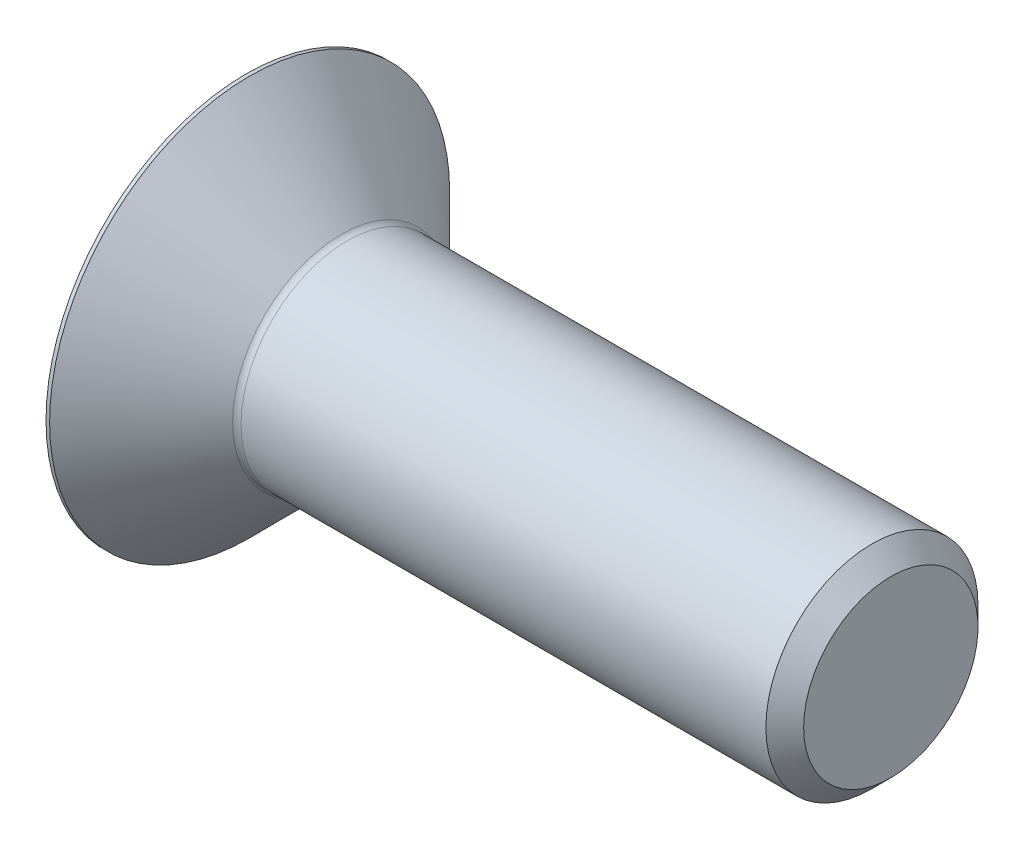
from build123d import *

# Parameters (mm, degrees)
FILLET1_R        = 0.2
HEX_2_DEPTH      = 1.9
EXTRUSION1_START = -0.8
ESQUISSE1_R      = 4.715
EXTRUSION1_DEPTH = 0.8


with BuildPart() as part:
    # BodySke → BaseBody (revolve)
    with BuildSketch(Plane.XY, mode=Mode.PRIVATE) as basebody_sk:
        Polygon((0, 0), (0, 4.715), (0.885, 4.715), (3.1, 2.5), (15.555, 2.5), (16, 2.055), (16, 0), align=None)
    revolve(basebody_sk.sketch.rotate(Axis((0, 0, 0), (1, 0, 0)), 90), axis=Axis((0, 0, 0), (1, 0, 0)))

    # Fillet1
    fillet1_edges = [part.edges().sort_by_distance(p)[0] for p in [
        (3.1, 0, -2.5),
    ]]
    fillet(fillet1_edges, radius=FILLET1_R)

    # Sketch2 → PreBroach (revolve, cut)
    with BuildSketch(Plane.XY, mode=Mode.PRIVATE) as prebroach_sk:
        Polygon((0, 1.5), (1.9, 1.5), (2.766025404, 0), (0, 0), align=None)
    revolve(prebroach_sk.sketch.rotate(Axis((0, 0, 0), (1, 0, 0)), 90), axis=Axis((0, 0, 0), (1, 0, 0)), mode=Mode.SUBTRACT)

    # Sketch3 → Hex 2 (cut)
    with BuildSketch(Plane.ZY):
        Polygon((-1.5, -0.866025404), (-1.5, 0.866025404), (0, 1.732050808), (1.5, 0.866025404), (1.5, -0.866025404), (0, -1.732050808), align=None)
    extrude(amount=-HEX_2_DEPTH, mode=Mode.SUBTRACT)

    # Esquisse1 → Extrusion1 (cut)
    with BuildSketch(Plane.ZY.offset(EXTRUSION1_START)):
        Circle(ESQUISSE1_R)
    extrude(amount=EXTRUSION1_DEPTH, mode=Mode.SUBTRACT)


solid = part.part
